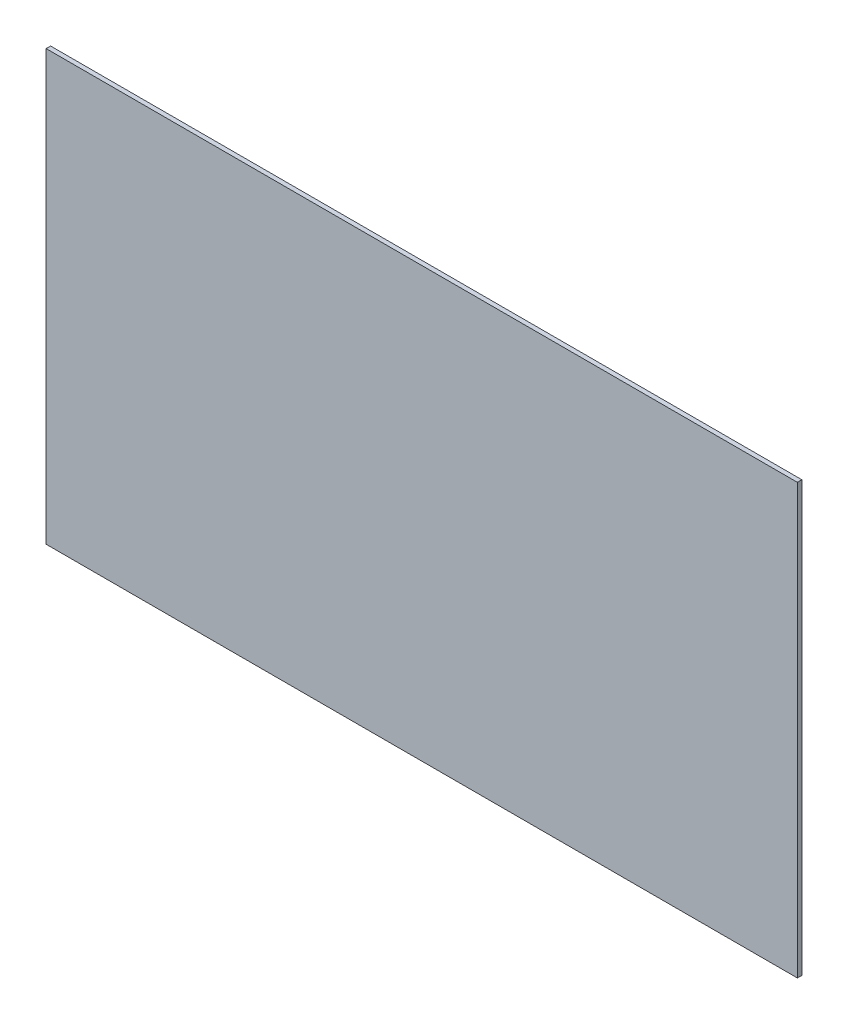
from build123d import *

# Parameters (mm, degrees)
CROQUIS1_W              = 533.4
CROQUIS1_H              = 304.8
SALIENTE_EXTRUIR1_DEPTH = 3.175


with BuildPart() as part:
    # Croquis1 → Saliente-Extruir1 (new body)
    with BuildSketch(Plane.XY):
        with Locations((266.7, 152.4)):
            Rectangle(CROQUIS1_W, CROQUIS1_H)
    extrude(amount=SALIENTE_EXTRUIR1_DEPTH)


solid = part.part
